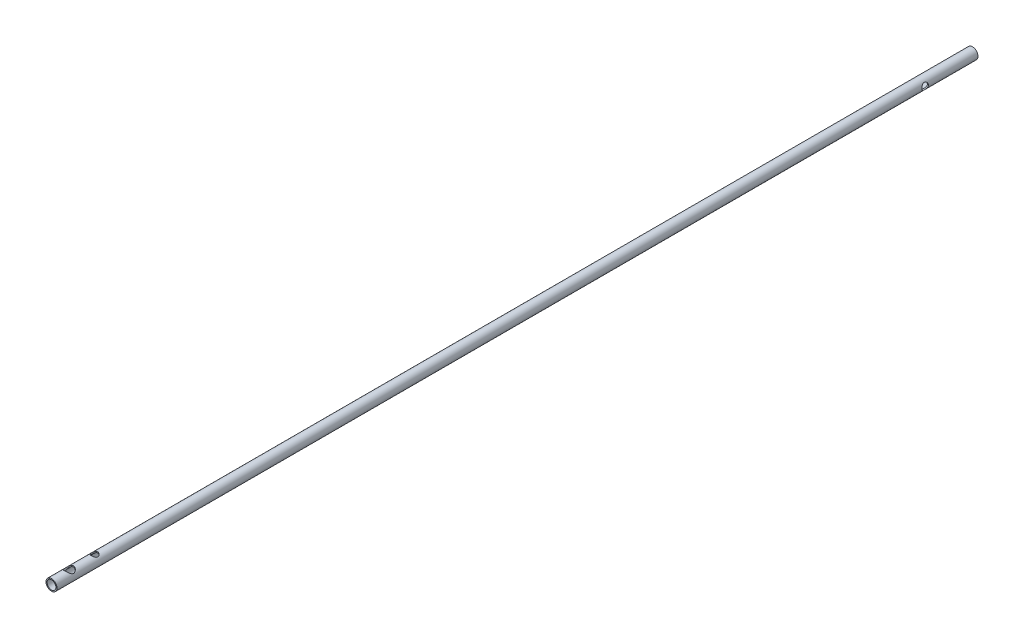
from build123d import *

# Parameters (mm, degrees)
SKETCH_1_R               = 5
SKETCH_1_R_2             = 4
EXTRUDE_1_DEPTH          = 836.5
CUT_EXTRUDE_1_DEPTH      = 837.529885898
CUT_EXTRUDE_1_DEPTH_BACK = 837.529885898
SKETCH_2_R               = 2
SKETCH_2_R_2             = 1.5
SKETCH_2_3_R             = 4
SKETCH_2_3_R_2           = 3
CUT_EXTRUDE_2_DEPTH      = 837.529885999
CUT_EXTRUDE_3_DEPTH      = 837.529885999
CUT_EXTRUDE_3_DEPTH_BACK = 837.529885999
SKETCH_3_R               = 1.5
SKETCH_3_3_R             = 3
CUT_EXTRUDE_4_DEPTH      = 10


with BuildPart() as part:
    # ｽｹｯﾁ1 → 押し出し-薄板1 (new body)
    with BuildSketch(Plane.XY):
        Circle(SKETCH_1_R)
        Circle(SKETCH_1_R_2, mode=Mode.SUBTRACT)
    extrude(amount=EXTRUDE_1_DEPTH)

    # ｽｹｯﾁ2 → ｶｯﾄ - 押し出し1 (cut, two sides: drawn at the far end of the back side and taken through both)
    with BuildSketch(Plane(origin=(0, 0, 0), x_dir=(1, 0, 0), z_dir=(0, 1, 0)).offset(-CUT_EXTRUDE_1_DEPTH_BACK)):
        with Locations((0, -820.5)):
            Circle(SKETCH_2_R)
        with Locations((0, -797.5)):
            Circle(SKETCH_2_R_2)
    extrude(amount=CUT_EXTRUDE_1_DEPTH + CUT_EXTRUDE_1_DEPTH_BACK, mode=Mode.SUBTRACT)

    # ｽｹｯﾁ2<3> → ｶｯﾄ - 押し出し2 (cut, through all)
    with BuildSketch(Plane(origin=(0, 0, 0), x_dir=(1, 0, 0), z_dir=(0, 1, 0))):
        with Locations((0, -820.5)):
            Circle(SKETCH_2_3_R)
        with Locations((0, -797.5)):
            Circle(SKETCH_2_3_R_2)
    extrude(amount=CUT_EXTRUDE_2_DEPTH, mode=Mode.SUBTRACT)

    # ｽｹｯﾁ3 → ｶｯﾄ - 押し出し3 (cut, two sides: drawn at the far end of the back side and taken through both)
    with BuildSketch(Plane(origin=(0, 0, 0), x_dir=(0, 0, -1), z_dir=(1, 0, 0)).offset(-CUT_EXTRUDE_3_DEPTH_BACK)):
        with Locations((-48, 0)):
            Circle(SKETCH_3_R)
    extrude(amount=CUT_EXTRUDE_3_DEPTH + CUT_EXTRUDE_3_DEPTH_BACK, mode=Mode.SUBTRACT)

    # ｽｹｯﾁ3<3> → ｶｯﾄ - 押し出し4 (cut)
    with BuildSketch(Plane(origin=(0, 0, 0), x_dir=(0, 0, -1), z_dir=(1, 0, 0))):
        with Locations((-48, 0)):
            Circle(SKETCH_3_3_R)
    extrude(amount=CUT_EXTRUDE_4_DEPTH, mode=Mode.SUBTRACT)


solid = part.part
